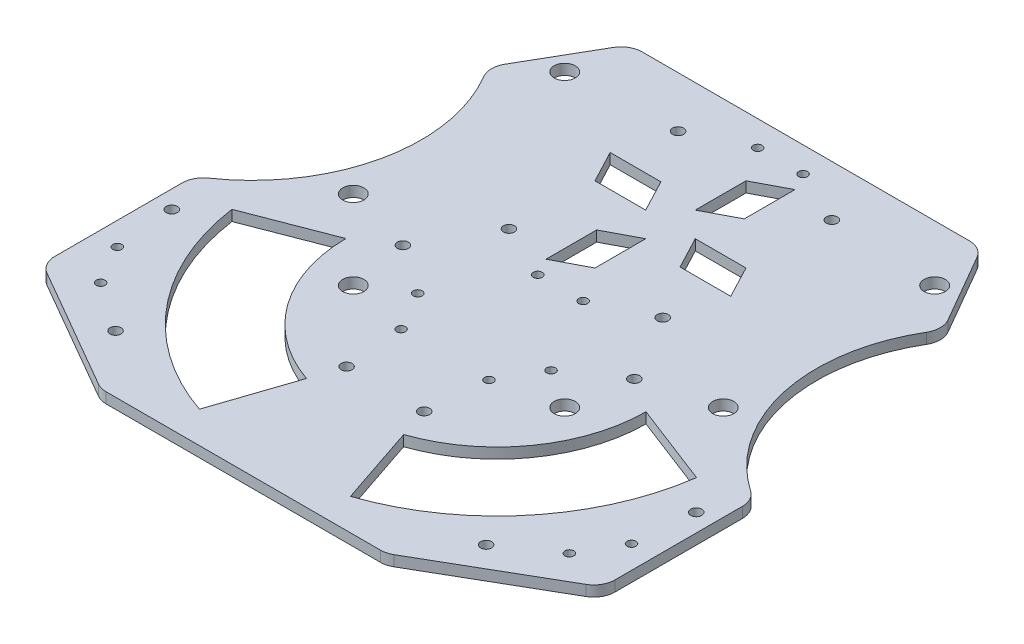
from build123d import *

# Parameters (mm, degrees)
EXTRUDE_1_DEPTH          = 5
SKETCH_2_R               = 2.1
SKETCH_2_R_2             = 2.6
CUT_EXTRUDE_1_DEPTH      = 10
PATTERN_CIRCULAR_1_COUNT = 3
EXTRUDE_3_DEPTH          = 5
SKETCH_6_R               = 5
CUT_EXTRUDE_2_DEPTH      = 285.979522771
CUT_EXTRUDE_4_DEPTH      = 285.979522771
CUT_EXTRUDE_5_DEPTH      = 242.721592744
CUT_EXTRUDE_6_DEPTH      = 10
FILLET_1_R               = 10
FILLET_2_R               = 10


with BuildPart() as part:
    # 草图1 → 凸台-拉伸1 (new body)
    with BuildSketch(Plane(origin=(0, 0, 0), x_dir=(1, 0, 0), z_dir=(0, 1, 0))):
        with BuildLine():
            Line((-34.641016151, 150), (-147.224318643, -45))
            ThreePointArc((-147.224318643, -45), (-147.224318643, -85), (-112.583302492, -105))
            Line((-112.583302492, -105), (112.583302492, -105))
            ThreePointArc((112.583302492, -105), (147.224318643, -85), (147.224318643, -45))
            Line((147.224318643, -45), (34.641016151, 150))
            ThreePointArc((34.641016151, 150), (0, 170), (-34.641016151, 150))
        make_face()
    extrude(amount=EXTRUDE_1_DEPTH)

    # 草图2 → 切除-拉伸1 (cut)
    with BuildSketch(Plane(origin=(0, 5, 0), x_dir=(1, 0, 0), z_dir=(0, 1, 0))):
        with Locations(Location((-10.75, 30, 0), (0, 0, 270))):
            Circle(SKETCH_2_R)
        with Locations(Location((-10.75, 134, 0), (0, 0, 270))):
            Circle(SKETCH_2_R)
        with Locations(Location((10.75, 30, 0), (0, 0, 270))):
            Circle(SKETCH_2_R)
        with Locations(Location((10.75, 134, 0), (0, 0, 270))):
            Circle(SKETCH_2_R)
        with Locations(Location((-36.38, 42, 0), (0, 0, 270))):
            Circle(SKETCH_2_R_2)
        with Locations(Location((-36.38, 122, 0), (0, 0, 270))):
            Circle(SKETCH_2_R_2)
        with Locations(Location((36.38, 122, 0), (0, 0, 270))):
            Circle(SKETCH_2_R_2)
        with Locations(Location((36.38, 42, 0), (0, 0, 270))):
            Circle(SKETCH_2_R_2)
    cut_extrude_1 = extrude(amount=-CUT_EXTRUDE_1_DEPTH, mode=Mode.SUBTRACT)

    # 阵列(圆周)1: 切除-拉伸1 ×3 about axis
    pattern_circular_1_axis = Axis((0, 0, 0.213703285), (0, 1, 0))
    for i in range(1, PATTERN_CIRCULAR_1_COUNT):
        add(cut_extrude_1.rotate(pattern_circular_1_axis, i * 360 / PATTERN_CIRCULAR_1_COUNT), mode=Mode.SUBTRACT)

    # 草图5 → 凸台-拉伸3 (add)
    with BuildSketch(Plane.XZ):
        with BuildLine():
            Line((69.282032303, -170), (181.865334795, 25))
            ThreePointArc((181.865334795, 25), (181.865334795, 105), (112.583302492, 145))
            Line((112.583302492, 145), (-112.583302492, 145))
            ThreePointArc((-112.583302492, 145), (-181.865334795, 105), (-181.865334795, 25))
            Line((-181.865334795, 25), (-69.282032303, -170))
            ThreePointArc((-69.282032303, -170), (0, -210), (69.282032303, -170))
        make_face()
        with BuildLine():
            Line((-147.224318643, 45), (-34.641016151, -150))
            ThreePointArc((-34.641016151, -150), (0, -170), (34.641016151, -150))
            Line((34.641016151, -150), (147.224318643, 45))
            ThreePointArc((147.224318643, 45), (147.224318643, 85), (112.583302492, 105))
            Line((112.583302492, 105), (-112.583302492, 105))
            ThreePointArc((-112.583302492, 105), (-147.224318643, 85), (-147.224318643, 45))
        make_face(mode=Mode.SUBTRACT)
    extrude(amount=-EXTRUDE_3_DEPTH)

    # 草图6 → 切除-拉伸2 (cut, through all)
    with BuildSketch(Plane(origin=(0, 5, 0), x_dir=(1, 0, 0), z_dir=(0, 1, 0))):
        with Locations(Location((-87.5, 119.5, 0), (0, 0, 270))):
            Circle(SKETCH_6_R)
        with Locations(Location((-87.5, 19.5, 0), (0, 0, 270))):
            Circle(SKETCH_6_R)
        with Locations(Location((87.5, 19.5, 0), (0, 0, 90))):
            Circle(SKETCH_6_R)
        with Locations(Location((87.5, 119.5, 0), (0, 0, 90))):
            Circle(SKETCH_6_R)
        with Locations(Location((-50, -18, 0), (0, 0, 90))):
            Circle(SKETCH_6_R)
        with Locations(Location((50, -18, 0), (0, 0, 270))):
            Circle(SKETCH_6_R)
    extrude(amount=-CUT_EXTRUDE_2_DEPTH, mode=Mode.SUBTRACT)

    # 草图8 → 切除-拉伸4 (cut, through all)
    with BuildSketch(Plane(origin=(0, 5, 0), x_dir=(1, 0, 0), z_dir=(0, 1, 0))):
        with BuildLine():
            Line((-83.138438763, 146), (83.138438763, 146))
            Line((83.138438763, 146), (69.282032303, 170))
            ThreePointArc((69.282032303, 170), (0, 210), (-69.282032303, 170))
            Line((-69.282032303, 170), (-83.138438763, 146))
        make_face()
    extrude(amount=-CUT_EXTRUDE_4_DEPTH, mode=Mode.SUBTRACT)

    # 草图9 → 切除-拉伸5 (cut, through all)
    with BuildSketch(Plane(origin=(0, 5, 0), x_dir=(1, 0, 0), z_dir=(0, 1, 0))):
        with BuildLine():
            Line((-132.501886779, 60.5), (-132.501886779, -82.5))
            Line((-132.501886779, -82.5), (-67.549981495, -120))
            Line((-67.549981495, -120), (67.549981495, -120))
            Line((67.549981495, -120), (132.501886779, -82.5))
            Line((132.501886779, -82.5), (132.501886779, 60.5))
            Line((132.501886779, 60.5), (181.865334795, -25))
            ThreePointArc((181.865334795, -25), (181.865334795, -105), (112.583302492, -145))
            Line((112.583302492, -145), (-112.583302492, -145))
            ThreePointArc((-112.583302492, -145), (-181.865334795, -105), (-181.865334795, -25))
            Line((-181.865334795, -25), (-132.501886779, 60.5))
        make_face()
    extrude(amount=-CUT_EXTRUDE_5_DEPTH, mode=Mode.SUBTRACT)

    # 草图10 → 切除-拉伸6 (cut)
    with BuildSketch(Plane.XZ):
        with BuildLine():
            Line((-132.501886779, 11), (-132.501886779, -60.5))
            Line((-132.501886779, -60.5), (-107.820162771, -103.25))
            ThreePointArc((-107.820162771, -103.25), (-95.363092594, -40.767838354), (-132.501886779, 11))
        make_face()
        with BuildLine():
            Line((132.501886779, 11), (132.501886779, -60.5))
            Line((132.501886779, -60.5), (107.820162771, -103.25))
            ThreePointArc((107.820162771, -103.25), (95.363092594, -40.767838354), (132.501886779, 11))
        make_face()
        Polygon((0, -93.759719881), (0, -117.74775549), (15.192422552, -125.743767359), (15.192422552, -101.755731751), align=None)
        Polygon((-11.727484075, -82.032235806), (-35.715519683, -82.032235806), (-43.711531553, -97.224658358), (-19.723495945, -97.224658358), align=None)
        Polygon((0, -70.304751731), (0, -46.316716123), (-15.192422552, -38.320704253), (-15.192422552, -62.308739862), align=None)
        Polygon((11.727484075, -82.032235806), (35.715519683, -82.032235806), (43.711531553, -66.839813254), (19.723495945, -66.839813254), align=None)
        with BuildLine():
            Line((-109.888608331, 15.515490775), (-70.976675957, 0.514623515))
            ThreePointArc((-70.976675957, 0.514623515), (-57.594007807, 41.483534468), (-22.975810906, 67.157021081))
            Line((-22.975810906, 67.157021081), (-35.715519683, 105.074441939))
            ThreePointArc((-35.715519683, 105.074441939), (-85.471293176, 70.78767363), (-109.888608331, 15.515490775))
        make_face()
        with BuildLine():
            Line((109.888608331, 15.515490775), (70.976675957, 0.514623515))
            ThreePointArc((70.976675957, 0.514623515), (57.594007807, 41.483534468), (22.975810906, 67.157021081))
            Line((22.975810906, 67.157021081), (35.715519683, 105.074441939))
            ThreePointArc((35.715519683, 105.074441939), (85.471293176, 70.78767363), (109.888608331, 15.515490775))
        make_face()
    extrude(amount=-CUT_EXTRUDE_6_DEPTH, mode=Mode.SUBTRACT)

    # 圆角1
    fillet_1_edges = [part.edges().sort_by_distance(p)[0] for p in [
        (-83.138438763, 2.5, -146),
        (-132.501886779, 2.5, 82.5),
        (-132.501886779, 2.5, 11),
        (-107.820162771, 2.5, -103.25),
    ]]
    fillet(fillet_1_edges, radius=FILLET_1_R)

    # 圆角2
    fillet_2_edges = [part.edges().sort_by_distance(p)[0] for p in [
        (83.138438763, 2.5, -146),
        (-67.549981495, 2.5, 120),
        (67.549981495, 2.5, 120),
        (132.501886779, 2.5, 82.5),
        (132.501886779, 2.5, 11),
        (107.820162771, 2.5, -103.25),
    ]]
    fillet(fillet_2_edges, radius=FILLET_2_R)


solid = part.part
